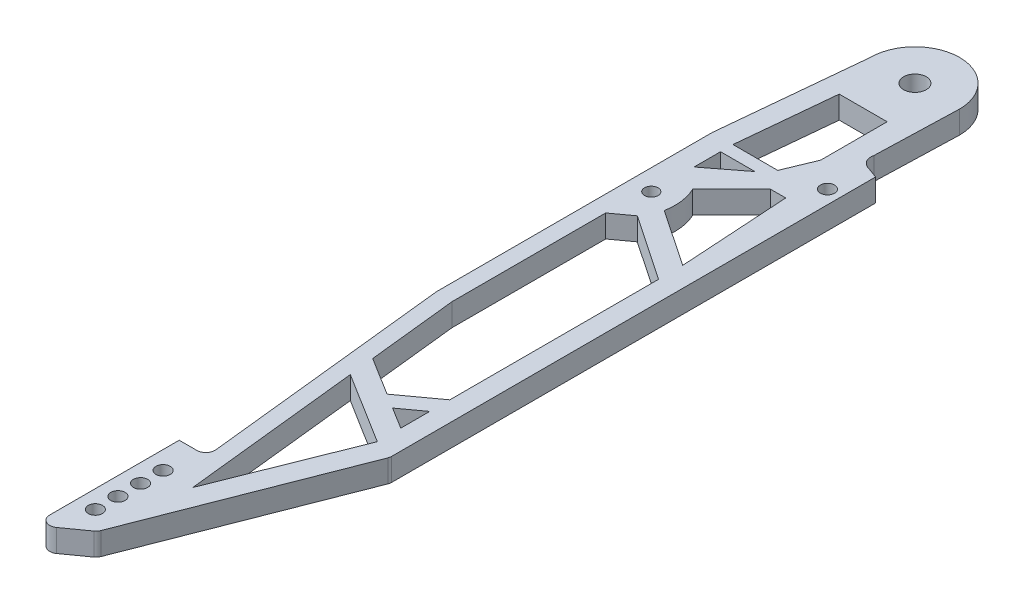
from build123d import *

# Parameters (mm, degrees)
SKETCH2_R           = 3.175
SKETCH2_R_2         = 2
SKETCH2_R_3         = 1.905
SKETCH2_R_4         = 1.999999991
BOSS_EXTRUDE1_DEPTH = 6.35
FILLET2_R           = 2.54
FILLET3_R           = 2.54
FILLET4_R           = 2.54
FILLET5_R           = 2.54


with BuildPart() as part:
    # Sketch2 → Boss-Extrude1 (new body)
    with BuildSketch(Plane(origin=(0, 0, 0), x_dir=(1, 0, 0), z_dir=(0, 1, 0))):
        with BuildLine():
            Line((13.846627418, -27.11715969), (17.295902343, -28.359470371))
            Line((17.295902343, -28.359470371), (17.295902343, -164.950770806))
            Line((17.295902343, -164.950770806), (-5.788689103, -224.106088723))
            Line((-5.788689103, -224.106088723), (-16.51, -231.775))
            Line((-16.51, -231.775), (-16.51, -190.41700733))
            Line((-16.51, -190.41700733), (-8.721771923, -190.41700733))
            Line((-8.721771923, -190.41700733), (-16.51, -118.11))
            Line((-16.51, -118.11), (-16.51, -40.527182032))
            Line((-16.51, -40.527182032), (-12.5603, 0))
            ThreePointArc((-12.5603, 0), (0, 12.5603), (12.5603, 0))
            Line((12.5603, 0), (11.834308479, -23.392641285))
            ThreePointArc((11.834308479, -23.392641285), (12.129138804, -25.639224299), (13.846627418, -27.11715969))
        make_face()
        with Locations(Location((0, 0, 0), (0, 0, 270))):
            Circle(SKETCH2_R, mode=Mode.SUBTRACT)
        with Locations(Location((-11.43, -219.075, 0), (0, 0, 270))):
            Circle(SKETCH2_R_2, mode=Mode.SUBTRACT)
        with Locations(Location((-11.43, -212.725, 0), (0, 0, 270))):
            Circle(SKETCH2_R_2, mode=Mode.SUBTRACT)
        with Locations(Location((-11.43, -206.375, 0), (0, 0, 270))):
            Circle(SKETCH2_R_2, mode=Mode.SUBTRACT)
        with Locations(Location((-11.43, -200.025, 0), (0, 0, 270))):
            Circle(SKETCH2_R_2, mode=Mode.SUBTRACT)
        with Locations(Location((-10.6553, -63.5, 0), (0, 0, 270))):
            Circle(SKETCH2_R_3, mode=Mode.SUBTRACT)
        with Locations(Location((13.485902343, -38.1, 0), (0, 0, 270))):
            Circle(SKETCH2_R_4, mode=Mode.SUBTRACT)
        Polygon((-3.088444979, -200.025), (-8.437091633, -150.367410486), (11.707902343, -162.914359455), align=None, mode=Mode.SUBTRACT)
        Polygon((5.669829362, -152.570430441), (11.707902343, -156.331136136), (11.707902343, -148.173239335), align=None, mode=Mode.SUBTRACT)
        Polygon((-9.197164207, -143.310789567), (1.48362655, -149.963128939), (11.707902343, -142.517360277), (11.707902343, -83.82613362), (-6.752611098, -71.345410911), (-11.894481361, -75.089947663), (-11.894481361, -118.268516882), align=None, mode=Mode.SUBTRACT)
        with BuildLine():
            Line((-5.45038708, -57.047318199), (5.477174601, -46.119756518))
            Line((5.477174601, -46.119756518), (9.770631453, -46.119756518))
            Line((9.770631453, -46.119756518), (11.707902343, -77.037423395))
            Line((11.707902343, -77.037423395), (-4.240626345, -66.254995008))
            ThreePointArc((-4.240626345, -66.254995008), (-4.111536449, -61.554723114), (-5.45038708, -57.047318199))
        make_face(mode=Mode.SUBTRACT)
        Polygon((-5.48107582, -40.527182032), (-10.6553, -40.527182032), (-8.00152211, -13.297230483), (5.477174601, -13.297230483), (5.477174601, -31.974105906), (1.94113758, -40.527182032), align=None, mode=Mode.SUBTRACT)
        Polygon((-10.6553, -44.022777243), (-10.6553, -51.472145687), (-0.991335505, -44.022777243), align=None, mode=Mode.SUBTRACT)
    extrude(amount=BOSS_EXTRUDE1_DEPTH)

    # Fillet2
    fillet2_edges = [part.edges().sort_by_distance(p)[0] for p in [
        (-8.721771923, 3.175, 190.41700733),
    ]]
    fillet(fillet2_edges, radius=FILLET2_R)

    # Fillet3
    fillet3_edges = [part.edges().sort_by_distance(p)[0] for p in [
        (-5.788689103, 3.175, 224.106088723),
    ]]
    fillet(fillet3_edges, radius=FILLET3_R)

    # Fillet4
    fillet4_edges = [part.edges().sort_by_distance(p)[0] for p in [
        (-16.51, 3.175, 231.775),
    ]]
    fillet(fillet4_edges, radius=FILLET4_R)

    # Fillet5
    fillet5_edges = [part.edges().sort_by_distance(p)[0] for p in [
        (17.295902343, 3.175, 164.950770806),
    ]]
    fillet(fillet5_edges, radius=FILLET5_R)


solid = part.part
